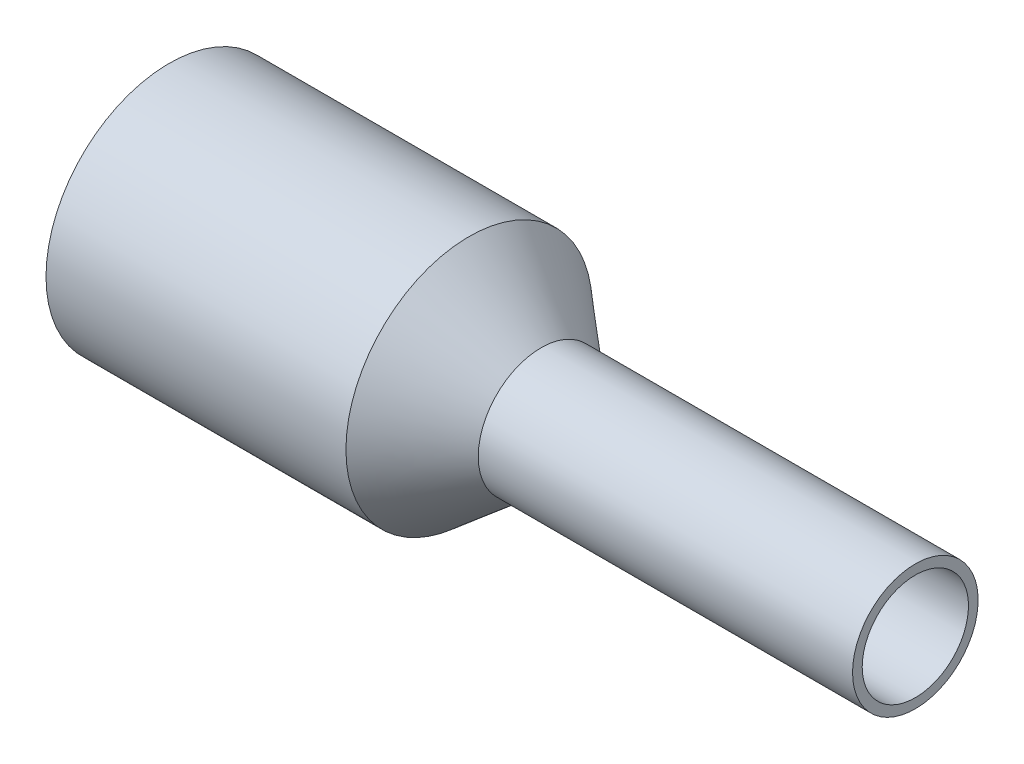
from build123d import *


with BuildPart() as part:
    # Croquis1 → Revolución1 (revolve)
    with BuildSketch(Plane.XY, mode=Mode.PRIVATE) as revoluci_n1_sk:
        Polygon((7.725, 1.1), (-0.025, 1.1), (-1.514691991, 2.05), (-7.725, 2.05), (-7.725, 2.55), (-1.514691991, 2.55), (-0.025, 1.3), (7.725, 1.3), align=None)
    revolve(revoluci_n1_sk.sketch.rotate(Axis((-7.725, 0, 0), (1, 0, 0)), 90), axis=Axis((-7.725, 0, 0), (1, 0, 0)))


solid = part.part
